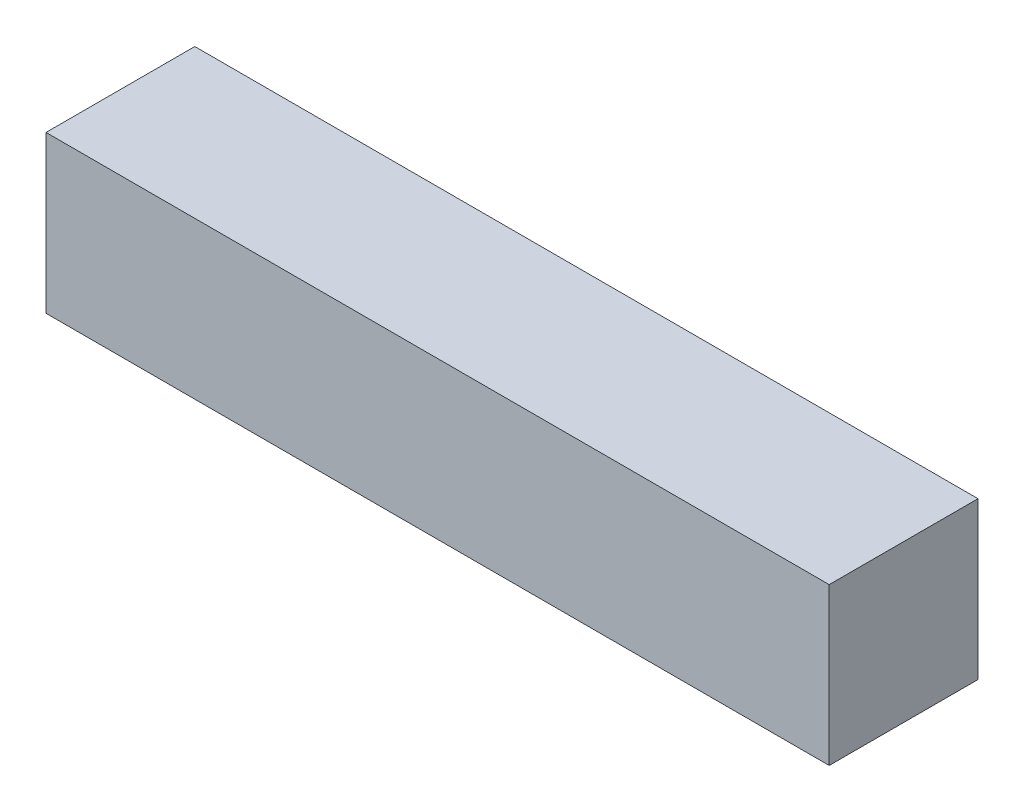
from build123d import *

# Parameters (mm, degrees)
SKETCH_1_W      = 100
SKETCH_1_H      = 20
EXTRUDE_1_DEPTH = 19
SKETCH_1_2_W    = 100
SKETCH_1_2_H    = 20
EXTRUDE_2_DEPTH = 19
SHELL_1_T       = -2
SKETCH_2_W      = 15
SKETCH_2_H      = 16
EXTRUDE_3_DEPTH = 2


with BuildPart() as part:
    # 草圖1 → 填料-伸長1 (new body)
    with BuildSketch(Plane.XY):
        Rectangle(SKETCH_1_W, SKETCH_1_H)
    extrude(amount=EXTRUDE_1_DEPTH)

    # 草圖1<2> → 填料-伸長2 (add)
    with BuildSketch(Plane.XY):
        Rectangle(SKETCH_1_2_W, SKETCH_1_2_H)
    extrude(amount=EXTRUDE_2_DEPTH)

    # 薄殼1
    shell_1_openings = [part.faces().sort_by_distance(p)[0] for p in [
        (-50, 0, 9.5),
    ]]
    offset(amount=SHELL_1_T, openings=shell_1_openings, kind=Kind.INTERSECTION)

    # 草圖2 → 填料-伸長3 (add)
    with BuildSketch(Plane.ZY.offset(50)):
        with Locations((9.5, 0)):
            Rectangle(SKETCH_2_W, SKETCH_2_H)
    extrude(amount=-EXTRUDE_3_DEPTH)


solid = part.part
